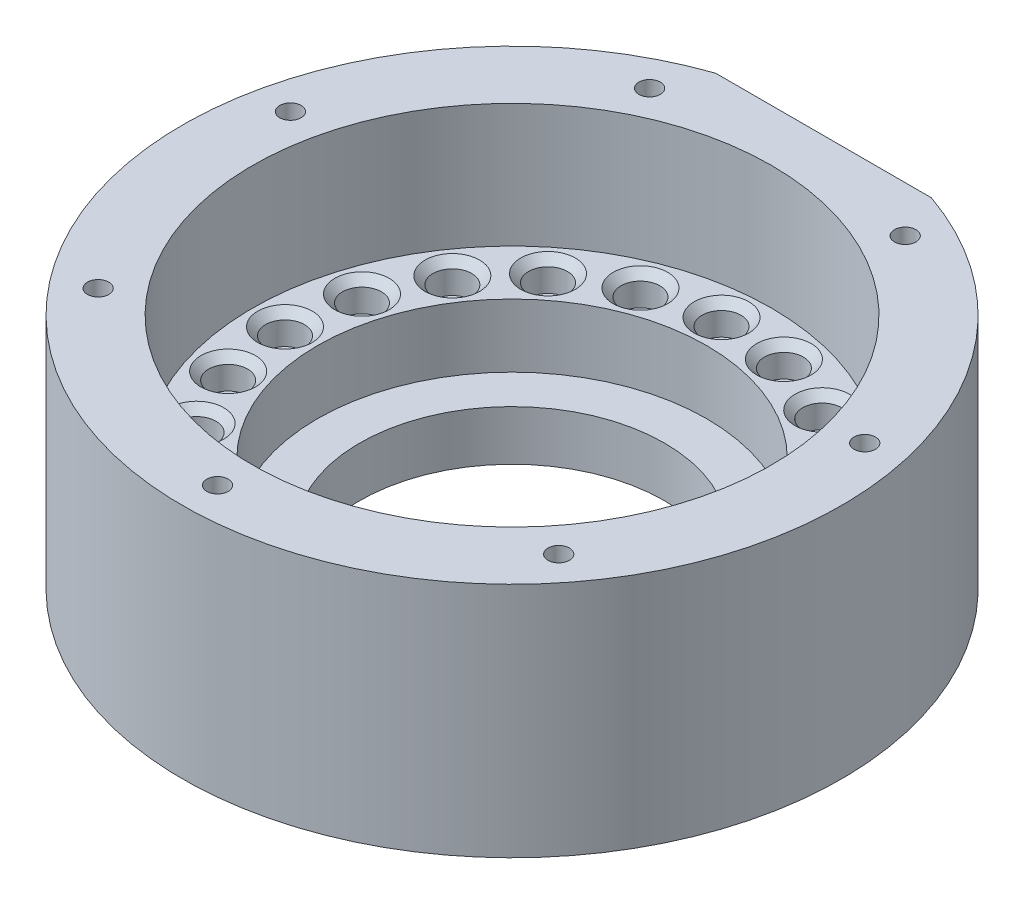
from build123d import *

# Parameters (mm, degrees)
SKETCH1_R                 = 50.8
SKETCH1_R_2               = 23.5
BOSS_EXTRUDE1_DEPTH       = 7.7
SKETCH3_R                 = 50.8
SKETCH3_R_2               = 30
BOSS_EXTRUDE2_DEPTH       = 9.7625
SKETCH4_R                 = 50.8
SKETCH4_R_2               = 40
BOSS_EXTRUDE3_DEPTH       = 19.05
SKETCH5_R                 = 3
CUT_EXTRUDE1_DEPTH        = 4.7625
CHAMFER1_SIZE             = 1.2
CUT_EXTRUDE4_DEPTH        = 81.58810493
M4X0_7_TAPPED_HOLE1_D     = 3.3
M4X0_7_TAPPED_HOLE1_DEPTH = 36.5135


with BuildPart() as part:
    # Sketch1 → Boss-Extrude1 (new body)
    with BuildSketch(Plane(origin=(0, 0, 0), x_dir=(1, 0, 0), z_dir=(0, 1, 0))):
        with Locations(Location((0, 0, 0), (0, 0, 90))):
            Circle(SKETCH1_R)
        with Locations(Location((0, 0, 0), (0, 0, 90))):
            Circle(SKETCH1_R_2, mode=Mode.SUBTRACT)
    extrude(amount=BOSS_EXTRUDE1_DEPTH)

    # Sketch3 → Boss-Extrude2 (add)
    with BuildSketch(Plane(origin=(0, 7.7, 0), x_dir=(1, 0, 0), z_dir=(0, 1, 0))):
        with Locations(Location((0, 0, 0), (0, 0, 90))):
            Circle(SKETCH3_R)
        with Locations(Location((0, 0, 0), (0, 0, 270))):
            Circle(SKETCH3_R_2, mode=Mode.SUBTRACT)
    extrude(amount=BOSS_EXTRUDE2_DEPTH)

    # Sketch4 → Boss-Extrude3 (add)
    with BuildSketch(Plane(origin=(0, 17.4625, 0), x_dir=(1, 0, 0), z_dir=(0, 1, 0))):
        with Locations(Location((0, 0, 0), (0, 0, 90))):
            Circle(SKETCH4_R)
        with Locations(Location((0, 0, 0), (0, 0, 90))):
            Circle(SKETCH4_R_2, mode=Mode.SUBTRACT)
    extrude(amount=BOSS_EXTRUDE3_DEPTH)

    # Sketch5 → Cut-Extrude1 (cut)
    with BuildSketch(Plane(origin=(0, 17.4625, 0), x_dir=(1, 0, 0), z_dir=(0, 1, 0))):
        with BuildLine():
            ThreePointArc((-38, 0), (-35, -3), (-32, 0))
            Line((-32, 0), (-38, 0))
        make_face()
        with BuildLine():
            Line((-38, 0), (-32, 0))
            ThreePointArc((-32, 0), (-35, 3), (-38, 0))
        make_face()
        with Locations(Location((-33.445048203, 10.316431104, 0), (0, 0, 270))):
            Circle(SKETCH5_R)
        with Locations(Location((-28.918357101, 19.716202032, 0), (0, 0, 270))):
            Circle(SKETCH5_R)
        with Locations(Location((-21.822143065, 27.364101886, 0), (0, 0, 270))):
            Circle(SKETCH5_R)
        with Locations(Location((-12.786935853, 32.580581203, 0), (0, 0, 270))):
            Circle(SKETCH5_R)
        with Locations(Location((-2.615553276, 34.902132901, 0), (0, 0, 270))):
            Circle(SKETCH5_R)
        with Locations(Location((7.788232688, 34.122476926, 0), (0, 0, 270))):
            Circle(SKETCH5_R)
        with Locations(Location((17.5, 30.310889132, 0), (0, 0, 270))):
            Circle(SKETCH5_R)
        with Locations(Location((25.656815514, 23.806045822, 0), (0, 0, 270))):
            Circle(SKETCH5_R)
        with Locations(Location((31.533910377, 15.185930869, 0), (0, 0, 270))):
            Circle(SKETCH5_R)
        with Locations(Location((34.609078918, 5.216479316, 0), (0, 0, 270))):
            Circle(SKETCH5_R)
        with Locations(Location((34.609078918, -5.216479316, 0), (0, 0, 270))):
            Circle(SKETCH5_R)
        with Locations(Location((31.533910377, -15.185930869, 0), (0, 0, 270))):
            Circle(SKETCH5_R)
        with Locations(Location((17.5, -30.310889132, 0), (0, 0, 270))):
            Circle(SKETCH5_R)
        with Locations(Location((7.788232688, -34.122476926, 0), (0, 0, 270))):
            Circle(SKETCH5_R)
        with Locations(Location((-2.615553276, -34.902132901, 0), (0, 0, 270))):
            Circle(SKETCH5_R)
        with Locations(Location((-12.786935853, -32.580581203, 0), (0, 0, 270))):
            Circle(SKETCH5_R)
        with Locations(Location((-21.822143065, -27.364101886, 0), (0, 0, 270))):
            Circle(SKETCH5_R)
        with Locations(Location((-28.918357101, -19.716202032, 0), (0, 0, 270))):
            Circle(SKETCH5_R)
        with Locations(Location((-33.445048203, -10.316431104, 0), (0, 0, 270))):
            Circle(SKETCH5_R)
        with Locations(Location((25.656815514, -23.806045822, 0), (0, 0, 270))):
            Circle(SKETCH5_R)
    extrude(amount=-CUT_EXTRUDE1_DEPTH, mode=Mode.SUBTRACT)

    # Chamfer1
    chamfer1_edges = [part.edges().sort_by_distance(p)[0] for p in [
        (-12.786935853, 17.4625, 29.580581203),
        (-2.615553276, 17.4625, 31.902132901),
        (7.788232688, 17.4625, 31.122476926),
        (17.5, 17.4625, 27.310889132),
        (31.533910377, 17.4625, 12.185930869),
        (34.609078918, 17.4625, 2.216479316),
        (34.609078918, 17.4625, -8.216479316),
        (31.533910377, 17.4625, -18.185930869),
        (25.656815514, 17.4625, -26.806045822),
        (17.5, 17.4625, -33.310889132),
        (7.788232688, 17.4625, -37.122476926),
        (-2.615553276, 17.4625, -37.902132901),
        (-12.786935853, 17.4625, -35.580581203),
        (-21.822143065, 17.4625, -30.364101886),
        (-28.918357101, 17.4625, -22.716202032),
        (-33.445048203, 17.4625, -13.316431104),
        (25.656815514, 17.4625, 20.806045822),
        (-33.445048203, 17.4625, 7.316431104),
        (-28.918357101, 17.4625, 16.716202032),
        (-21.822143065, 17.4625, 24.364101886),
        (-38, 17.4625, 0),
    ]]
    chamfer(chamfer1_edges, length=CHAMFER1_SIZE)

    # Sketch9 → Cut-Extrude4 (cut, through all)
    with BuildSketch(Plane(origin=(0, 36.5125, 0), x_dir=(1, 0, 0), z_dir=(0, 1, 0))):
        with BuildLine():
            Line((-16.632498309, 48), (0, 48))
            Line((0, 48), (16.632498309, 48))
            ThreePointArc((16.632498309, 48), (0, 50.8), (-16.632498309, 48))
        make_face()
    extrude(amount=-CUT_EXTRUDE4_DEPTH, mode=Mode.SUBTRACT)

    # M4x0.7 Tapped Hole1
    with Locations(Plane(origin=(0, 36.5125, 0), x_dir=(1, 0, 0), z_dir=(0, 1, 0))):
        with Locations((0, -45.4), (0, 0), (-44.261727213, 10.102450402), (-35.495149304, -28.306437004), (-19.698321756, 40.903986603), (19.698321756, 40.903986603), (44.261727213, 10.102450402), (35.495149304, -28.306437004)):
            Hole(M4X0_7_TAPPED_HOLE1_D / 2, depth=M4X0_7_TAPPED_HOLE1_DEPTH)


solid = part.part
